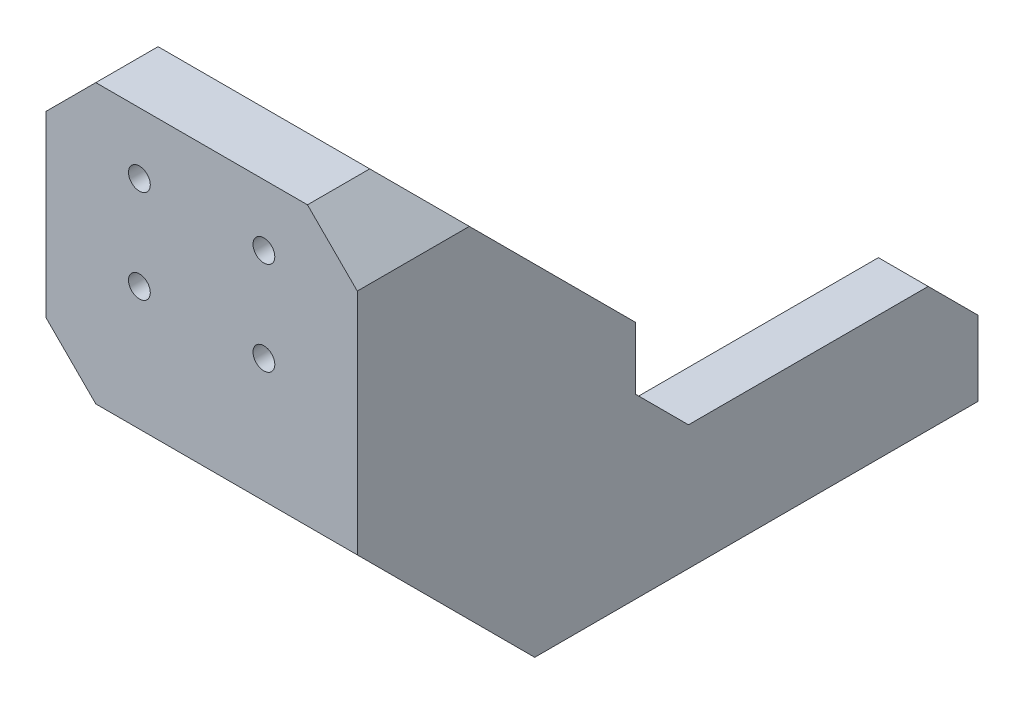
from build123d import *

# Parameters (mm, degrees)
SKETCH1_W           = 50
SKETCH1_H           = 34.7
BOSS_EXTRUDE1_DEPTH = 10
CUT_EXTRUDE1_REACH  = 34.032
SKETCH2_R           = 1.75
SKETCH3_R           = 3
CUT_EXTRUDE2_DEPTH  = 5
SKETCH6_W           = 50
SKETCH6_H           = 10
BOSS_EXTRUDE3_DEPTH = 44.7
BOSS_EXTRUDE4_DEPTH = 8
BOSS_EXTRUDE5_DEPTH = 8
CHAMFER1_SIZE       = 8
CUT_EXTRUDE3_REACH  = 105.292
SKETCH10_R          = 1.75
CHAMFER2_SIZE       = 8


with BuildPart() as part:
    # Sketch1 → Boss-Extrude1 (new body)
    with BuildSketch(Plane(origin=(0, 0, 0), x_dir=(1, 0, 0), z_dir=(0, 1, 0))):
        Rectangle(SKETCH1_W, SKETCH1_H)
    extrude(amount=BOSS_EXTRUDE1_DEPTH)

    # Sketch2 → Cut-Extrude1 (cut, up to next)
    with BuildSketch(Plane(origin=(0, 10, 0), x_dir=(1, 0, 0), z_dir=(0, 1, 0)), mode=Mode.PRIVATE) as cut_extrude1_sk1:
        with Locations(Location((-10, 7.5, 0), (0, 0, 270))):
            Circle(SKETCH2_R)
    cut_extrude1_tool1 = extrude(cut_extrude1_sk1.sketch, amount=-CUT_EXTRUDE1_REACH, mode=Mode.PRIVATE) & part.part
    # Sketch2 → Cut-Extrude1 (cut, up to next)
    with BuildSketch(Plane(origin=(0, 10, 0), x_dir=(1, 0, 0), z_dir=(0, 1, 0)), mode=Mode.PRIVATE) as cut_extrude1_sk2:
        with Locations(Location((10, 7.5, 0), (0, 0, 270))):
            Circle(SKETCH2_R)
    cut_extrude1_tool2 = extrude(cut_extrude1_sk2.sketch, amount=-CUT_EXTRUDE1_REACH, mode=Mode.PRIVATE) & part.part
    # Sketch2 → Cut-Extrude1 (cut, up to next)
    with BuildSketch(Plane(origin=(0, 10, 0), x_dir=(1, 0, 0), z_dir=(0, 1, 0)), mode=Mode.PRIVATE) as cut_extrude1_sk3:
        with Locations(Location((10, -7.5, 0), (0, 0, 270))):
            Circle(SKETCH2_R)
    cut_extrude1_tool3 = extrude(cut_extrude1_sk3.sketch, amount=-CUT_EXTRUDE1_REACH, mode=Mode.PRIVATE) & part.part
    # Sketch2 → Cut-Extrude1 (cut, up to next)
    with BuildSketch(Plane(origin=(0, 10, 0), x_dir=(1, 0, 0), z_dir=(0, 1, 0)), mode=Mode.PRIVATE) as cut_extrude1_sk4:
        with Locations(Location((-10, -7.5, 0), (0, 0, 270))):
            Circle(SKETCH2_R)
    cut_extrude1_tool4 = extrude(cut_extrude1_sk4.sketch, amount=-CUT_EXTRUDE1_REACH, mode=Mode.PRIVATE) & part.part
    add(cut_extrude1_tool1.solids().sort_by_distance((-10, 10, -7.5))[0], mode=Mode.SUBTRACT)
    add(cut_extrude1_tool2.solids().sort_by_distance((10, 10, -7.5))[0], mode=Mode.SUBTRACT)
    add(cut_extrude1_tool3.solids().sort_by_distance((10, 10, 7.5))[0], mode=Mode.SUBTRACT)
    add(cut_extrude1_tool4.solids().sort_by_distance((-10, 10, 7.5))[0], mode=Mode.SUBTRACT)

    # Sketch3 → Cut-Extrude2 (cut)
    with BuildSketch(Plane(origin=(0, 10, 0), x_dir=(1, 0, 0), z_dir=(0, 1, 0))):
        with Locations(Location((-10, 7.5, 0), (0, 0, 270))):
            Circle(SKETCH3_R)
        with Locations(Location((10, 7.5, 0), (0, 0, 270))):
            Circle(SKETCH3_R)
        with Locations(Location((10, -7.5, 0), (0, 0, 270))):
            Circle(SKETCH3_R)
        with Locations(Location((-10, -7.5, 0), (0, 0, 270))):
            Circle(SKETCH3_R)
    extrude(amount=-CUT_EXTRUDE2_DEPTH, mode=Mode.SUBTRACT)

    # Sketch6 → Boss-Extrude3 (add)
    with BuildSketch(Plane.XZ):
        with Locations((0, 22.35)):
            Rectangle(SKETCH6_W, SKETCH6_H)
    extrude(amount=-BOSS_EXTRUDE3_DEPTH)

    # Sketch8 → Boss-Extrude4 (add)
    with BuildSketch(Plane(origin=(25, 0, 0), x_dir=(0, 0, -1), z_dir=(1, 0, 0))):
        Polygon((-27.35, 0), (17.35, 0), (25.85, -8.5), (72.35, -8.5), (72.35, -28.5), (1.15, -28.5), align=None)
    extrude(amount=-BOSS_EXTRUDE4_DEPTH)

    # Sketch9 → Boss-Extrude5 (add)
    with BuildSketch(Plane(origin=(25, 0, 0), x_dir=(0, 0, -1), z_dir=(1, 0, 0))):
        Polygon((-17.35, 44.7), (17.35, 10), (-17.35, 10), align=None)
    boss_extrude5 = extrude(amount=-BOSS_EXTRUDE5_DEPTH)

    # Chamfer1
    chamfer1_edges = [part.edges().sort_by_distance(p)[0] for p in [
        (21, -8.5, -72.35),
    ]]
    chamfer(chamfer1_edges, length=CHAMFER1_SIZE)

    # Mirror1: Boss-Extrude5 across plane
    add(boss_extrude5.mirror(Plane(origin=(0, 0, 0), x_dir=(0, 0, 1), z_dir=(1, 0, 0))))

    # Sketch10 → Cut-Extrude3 (cut, up to next)
    with BuildSketch(Plane(origin=(0, 0, 17.35), x_dir=(-1, 0, 0), z_dir=(0, 0, -1)), mode=Mode.PRIVATE) as cut_extrude3_sk1:
        with Locations((-10, 34.85)):
            Circle(SKETCH10_R)
    cut_extrude3_tool1 = extrude(cut_extrude3_sk1.sketch, amount=-CUT_EXTRUDE3_REACH, mode=Mode.PRIVATE) & part.part
    # Sketch10 → Cut-Extrude3 (cut, up to next)
    with BuildSketch(Plane(origin=(0, 0, 17.35), x_dir=(-1, 0, 0), z_dir=(0, 0, -1)), mode=Mode.PRIVATE) as cut_extrude3_sk2:
        with Locations((10, 34.85)):
            Circle(SKETCH10_R)
    cut_extrude3_tool2 = extrude(cut_extrude3_sk2.sketch, amount=-CUT_EXTRUDE3_REACH, mode=Mode.PRIVATE) & part.part
    # Sketch10 → Cut-Extrude3 (cut, up to next)
    with BuildSketch(Plane(origin=(0, 0, 17.35), x_dir=(-1, 0, 0), z_dir=(0, 0, -1)), mode=Mode.PRIVATE) as cut_extrude3_sk3:
        with Locations((10, 19.85)):
            Circle(SKETCH10_R)
    cut_extrude3_tool3 = extrude(cut_extrude3_sk3.sketch, amount=-CUT_EXTRUDE3_REACH, mode=Mode.PRIVATE) & part.part
    # Sketch10 → Cut-Extrude3 (cut, up to next)
    with BuildSketch(Plane(origin=(0, 0, 17.35), x_dir=(-1, 0, 0), z_dir=(0, 0, -1)), mode=Mode.PRIVATE) as cut_extrude3_sk4:
        with Locations((-10, 19.85)):
            Circle(SKETCH10_R)
    cut_extrude3_tool4 = extrude(cut_extrude3_sk4.sketch, amount=-CUT_EXTRUDE3_REACH, mode=Mode.PRIVATE) & part.part
    add(cut_extrude3_tool1.solids().sort_by_distance((10, 34.85, 17.35))[0], mode=Mode.SUBTRACT)
    add(cut_extrude3_tool2.solids().sort_by_distance((-10, 34.85, 17.35))[0], mode=Mode.SUBTRACT)
    add(cut_extrude3_tool3.solids().sort_by_distance((-10, 19.85, 17.35))[0], mode=Mode.SUBTRACT)
    add(cut_extrude3_tool4.solids().sort_by_distance((10, 19.85, 17.35))[0], mode=Mode.SUBTRACT)

    # Chamfer2
    chamfer2_edges = [part.edges().sort_by_distance(p)[0] for p in [
        (25, 44.7, 22.35),
        (-25, 44.7, 22.35),
        (-25, 0, 5),
    ]]
    chamfer(chamfer2_edges, length=CHAMFER2_SIZE)


solid = part.part
